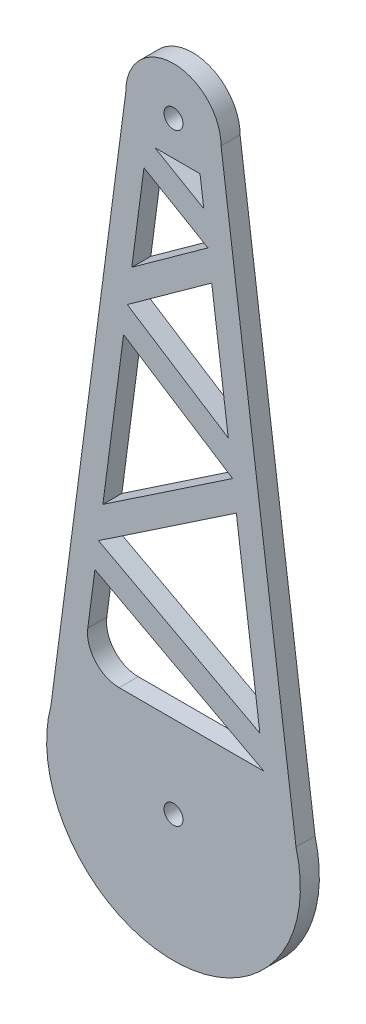
from build123d import *

# Parameters (mm, degrees)
SKETCH1_R           = 1.5
BOSS_EXTRUDE1_DEPTH = 3
FILLET1_R           = 5


with BuildPart() as part:
    # Sketch1 → Boss-Extrude1 (new body)
    with BuildSketch(Plane.XY):
        with BuildLine():
            Line((-19.319264806, 5.173587474), (-7.5, 95))
            ThreePointArc((-7.5, 95), (0, 102.5), (7.5, 95))
            Line((7.5, 95), (19.319264806, 5.173587474))
            ThreePointArc((19.319264806, 5.173587474), (0, -20), (-19.319264806, 5.173587474))
        make_face()
        with Locations((0, 95)):
            Circle(SKETCH1_R, mode=Mode.SUBTRACT)
        Circle(SKETCH1_R, mode=Mode.SUBTRACT)
        Polygon((-14.254996232, 13), (14.254996232, 13), (-12.38556129, 27.207705563), align=None, mode=Mode.SUBTRACT)
        Polygon((-2.898329399, 89.534418399), (4.184678022, 89.534418399), (4.774242146, 85.053731057), align=None, mode=Mode.SUBTRACT)
        Polygon((-11.828187859, 31.443743635), (13.613494732, 17.875411404), (9.904156147, 46.066384645), align=None, mode=Mode.SUBTRACT)
        Polygon((-11.132206149, 36.73320463), (-7.866560771, 61.552109505), (9.321386275, 50.495435676), align=None, mode=Mode.SUBTRACT)
        Polygon((-7.289587852, 65.937103693), (8.637709175, 55.691381633), (6.027006268, 75.532723726), align=None, mode=Mode.SUBTRACT)
        Polygon((-6.572917095, 71.383801447), (5.434465341, 80.036034774), (-4.658887227, 85.930428438), align=None, mode=Mode.SUBTRACT)
    extrude(amount=BOSS_EXTRUDE1_DEPTH)

    # Fillet1
    fillet1_edges = [part.edges().sort_by_distance(p)[0] for p in [
        (-14.254996232, 13, 1.5),
    ]]
    fillet(fillet1_edges, radius=FILLET1_R)


solid = part.part
